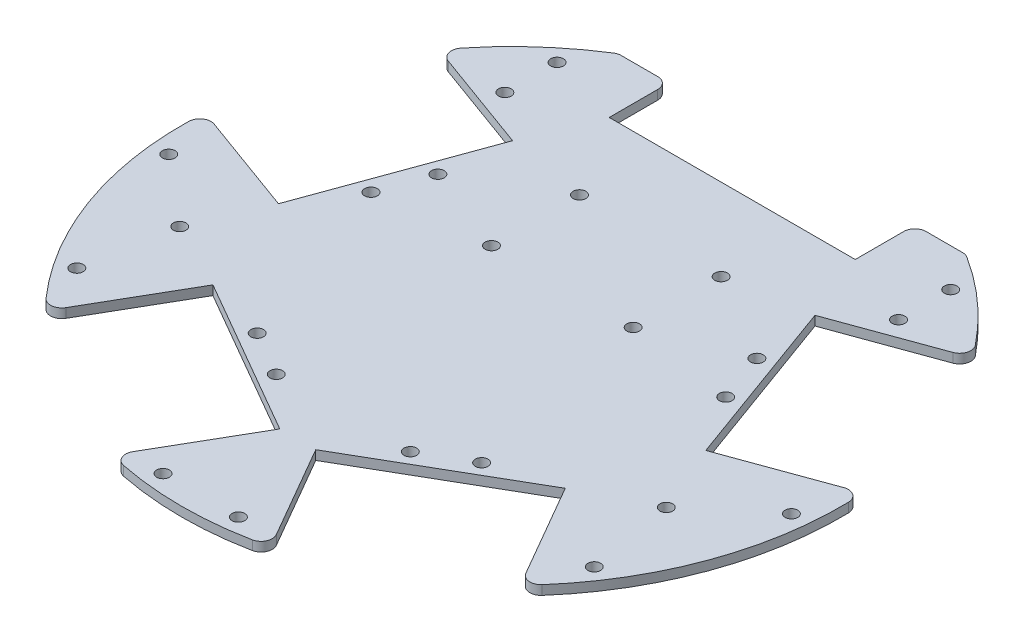
from build123d import *

# Parameters (mm, degrees)
CUTOFF_PROFILE_DEPTH = 2.5
FLANGED_HOLES_D      = 3.4
EXCESS_START         = -10
EXCESS_CUT_DEPTH     = 10
M3_CLEARANCE_HOLE1_D = 3.4
FILLET1_R            = 3
CUT_EXTRUDE2_START   = -2.5
CUT_EXTRUDE2_DEPTH   = 2.5
FILLET2_R            = 3
M3_CLEARANCE_HOLE2_D = 3.4


with BuildPart() as part:
    # Sketch1 → cutoff profile (new body)
    with BuildSketch(Plane(origin=(0, 0, 0), x_dir=(1, 0, 0), z_dir=(0, 1, 0))):
        with BuildLine():
            Line((-33, 83.194050268), (-33, 59.194050268))
            Line((-33, 59.194050268), (33, 59.194050268))
            Line((33, 59.194050268), (33, 83.194050268))
            ThreePointArc((33, 83.194050268), (54.947257978, 70.647355511), (72.510522323, 52.464027222))
            Line((72.510522323, 52.464027222), (40.560973217, 40.835342349))
            Line((40.560973217, 40.835342349), (57.31996024, -5.209596069))
            Line((57.31996024, -5.209596069), (89.269509346, 6.419088804))
            ThreePointArc((89.269509346, 6.419088804), (84.10248956, -30.610802828), (64.258300826, -62.298641839))
            Line((64.258300826, -62.298641839), (47.258300826, -32.85377811))
            Line((47.258300826, -32.85377811), (4.823056041, -57.35377811))
            Line((4.823056041, -57.35377811), (21.823056041, -86.798641839))
            ThreePointArc((21.823056041, -86.798641839), (0, -89.5), (-21.823056041, -86.798641839))
            Line((-21.823056041, -86.798641839), (-4.823056041, -57.35377811))
            Line((-4.823056041, -57.35377811), (-47.258300826, -32.85377811))
            Line((-47.258300826, -32.85377811), (-64.258300826, -62.298641839))
            ThreePointArc((-64.258300826, -62.298641839), (-84.10248956, -30.610802828), (-89.269509346, 6.419088804))
            Line((-89.269509346, 6.419088804), (-57.31996024, -5.209596069))
            Line((-57.31996024, -5.209596069), (-40.560973217, 40.835342349))
            Line((-40.560973217, 40.835342349), (-72.510522323, 52.464027222))
            ThreePointArc((-72.510522323, 52.464027222), (-54.947257978, 70.647355511), (-33, 83.194050268))
        make_face()
    extrude(amount=CUTOFF_PROFILE_DEPTH)

    # flanged holes (through all)
    with Locations(Plane(origin=(0, 2.5, 0), x_dir=(1, 0, 0), z_dir=(0, 1, 0))):
        with Locations((52.8, 65), (-17.978500607, -45.139676495), (-47.575837248, 9.866944221), (-30.10285626, -38.139676495), (-42.787555242, 23.022640912), (17.978500607, -45.139676495), (30.10285626, -38.139676495), (47.575837248, 9.866944221), (42.787555242, 23.022640912), (65.268611951, -23.755831982), (-65.268611951, -23.755831982), (-52.8, 51), (52.8, 51), (-52.8, 65)):
            Hole(FLANGED_HOLES_D / 2)

    # Sketch5 → excess cut (cut)
    with BuildSketch(Plane(origin=(0, 2.5, 0), x_dir=(1, 0, 0), z_dir=(0, 1, 0)).offset(EXCESS_START)):
        with BuildLine():
            ThreePointArc((21.302960858, -85.897810558), (10.730651555, -87.847043873), (0, -88.5))
            ThreePointArc((0, -88.5), (-10.730651555, -87.847043873), (-21.302960858, -85.897810558))
            Line((-21.302960858, -85.897810558), (-21.823056041, -86.798641839))
            ThreePointArc((-21.823056041, -86.798641839), (0, -89.5), (21.823056041, -86.798641839))
            Line((21.823056041, -86.798641839), (21.302960858, -85.897810558))
        make_face()
        with BuildLine():
            ThreePointArc((-64.258300826, -62.298641839), (0, 89.5), (64.258300826, -62.298641839))
            Line((64.258300826, -62.298641839), (63.738205644, -61.397810558))
            ThreePointArc((63.738205644, -61.397810558), (0, 88.5), (-63.738205644, -61.397810558))
            Line((-63.738205644, -61.397810558), (-64.258300826, -62.298641839))
        make_face()
    extrude(amount=EXCESS_CUT_DEPTH, mode=Mode.SUBTRACT)

    # M3 Clearance Hole1 (through all)
    with Locations(Plane(origin=(0, 2.5, 0), x_dir=(1, 0, 0), z_dir=(0, 1, 0))):
        with Locations((19, 37.217294159), (-19, 13.617294159), (-19, 37.217294159), (19, 13.617294159)):
            Hole(M3_CLEARANCE_HOLE1_D / 2)

    # Fillet1
    fillet1_edges = [part.edges().sort_by_distance(p)[0] for p in [
        (-21.302960858, 1.25, 85.897810558),
        (21.302960858, 1.25, 85.897810558),
        (-63.738205644, 1.25, 61.397810558),
        (-88.292050136, 1.25, -6.063322746),
        (88.292050136, 1.25, -6.063322746),
        (33, 1.25, -82.117294159),
        (-33, 1.25, -82.117294159),
        (-71.533063113, 1.25, -52.108261165),
        (71.533063113, 1.25, -52.108261165),
        (63.738205644, 1.25, 61.397810558),
    ]]
    fillet(fillet1_edges, radius=FILLET1_R)

    # Sketch9 → Cut-Extrude2 (cut)
    with BuildSketch(Plane(origin=(0, 2.5, 0), x_dir=(1, 0, 0), z_dir=(0, 1, 0)).offset(CUT_EXTRUDE2_START)):
        with BuildLine():
            ThreePointArc((-37.263157895, 80.27270435), (-36.646789817, 80.481043276), (-36, 80.551595728))
            ThreePointArc((-36, 80.551595728), (-33.878679656, 79.672916072), (-33, 77.551595728))
            Line((-33, 77.551595728), (-33, 75.201595728))
            Line((-33, 75.201595728), (33, 75.201595728))
            Line((33, 75.201595728), (33, 77.551595728))
            ThreePointArc((33, 77.551595728), (34.385917239, 80.08037742), (37.263157895, 80.27270435))
            ThreePointArc((37.263157895, 80.27270435), (42.037122726, 77.878946532), (46.658011101, 75.201595728))
            Line((46.658011101, 75.201595728), (56.845139831, 75.201595728))
            Line((56.845139831, 75.201595728), (56.845139831, 82.959992601))
            Line((56.845139831, 82.959992601), (-46.658011101, 82.959992601))
            Line((-46.658011101, 82.959992601), (-46.658011101, 75.201595728))
            ThreePointArc((-46.658011101, 75.201595728), (-42.037122726, 77.878946532), (-37.263157895, 80.27270435))
        make_face()
        with BuildLine():
            Line((-36, 75.201595728), (-36, 80.551595728))
            ThreePointArc((-36, 80.551595728), (-36.646789817, 80.481043276), (-37.263157895, 80.27270435))
            ThreePointArc((-37.263157895, 80.27270435), (-42.037122726, 77.878946532), (-46.658011101, 75.201595728))
            Line((-46.658011101, 75.201595728), (-36, 75.201595728))
        make_face()
        with BuildLine():
            ThreePointArc((-33, 77.551595728), (-33.878679656, 79.672916072), (-36, 80.551595728))
            Line((-36, 80.551595728), (-36, 75.201595728))
            Line((-36, 75.201595728), (-33, 75.201595728))
            Line((-33, 75.201595728), (-33, 77.551595728))
        make_face()
        with BuildLine():
            Line((33, 77.551595728), (33, 75.201595728))
            Line((33, 75.201595728), (46.658011101, 75.201595728))
            ThreePointArc((46.658011101, 75.201595728), (42.037122726, 77.878946532), (37.263157895, 80.27270435))
            ThreePointArc((37.263157895, 80.27270435), (34.385917239, 80.08037742), (33, 77.551595728))
        make_face()
    extrude(amount=CUT_EXTRUDE2_DEPTH, mode=Mode.SUBTRACT)

    # Fillet2
    fillet2_edges = [part.edges().sort_by_distance(p)[0] for p in [
        (-33, 1.25, -75.201595728),
        (-46.658011101, 1.25, -75.201595728),
        (33, 1.25, -75.201595728),
        (46.658011101, 1.25, -75.201595728),
    ]]
    fillet(fillet2_edges, radius=FILLET2_R)

    # M3 Clearance Hole2 (through all)
    with Locations(Plane(origin=(0, 2.5, 0), x_dir=(1, 0, 0), z_dir=(0, 1, 0))):
        with Locations((83.517603132, -8.443110213), (-69.405322414, -47.216282822), (-83.517603132, -8.443110213), (10.101112813, -83.386243549), (-10.101112813, -83.386243549), (69.405322414, -47.216282822)):
            Hole(M3_CLEARANCE_HOLE2_D / 2)


solid = part.part
